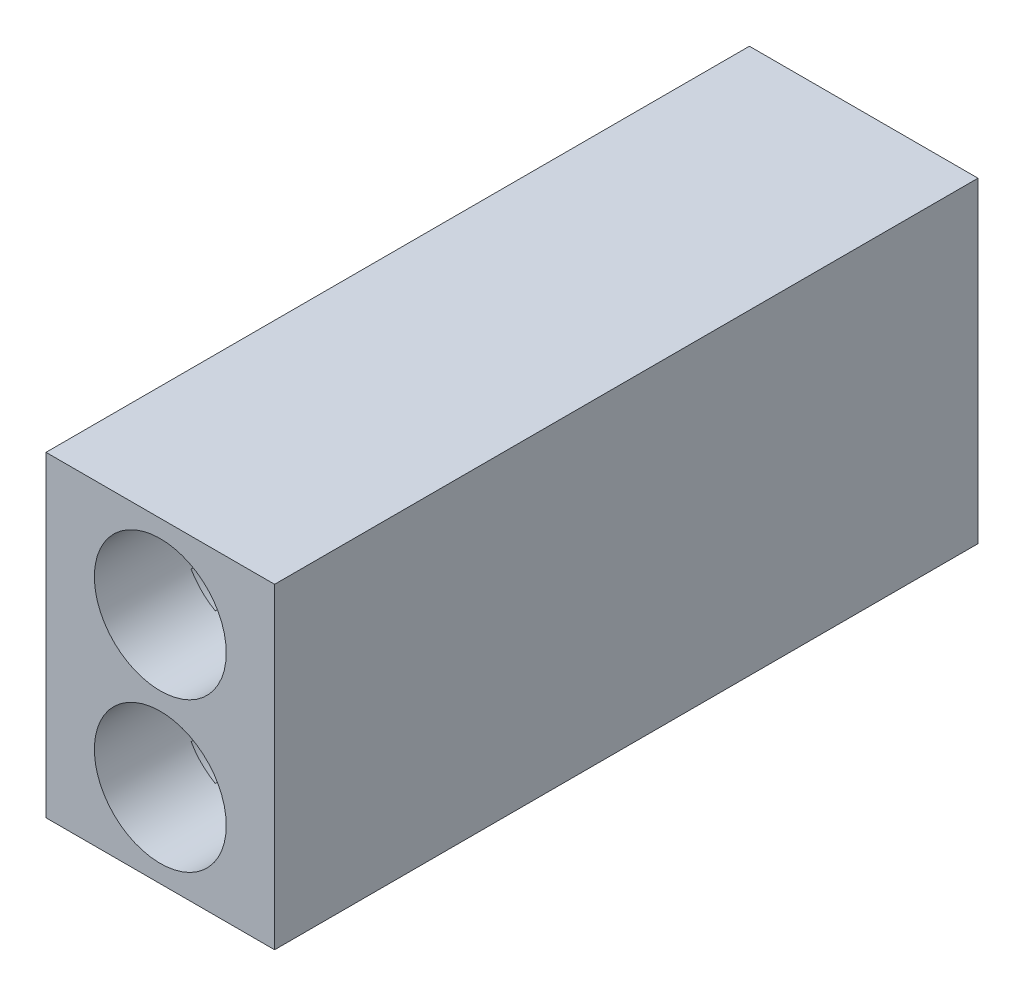
from build123d import *

# Parameters (mm, degrees)
SKETCH_1_W               = 130
SKETCH_1_H               = 180
EXTRUDE_1_DEPTH          = 400
SKETCH_2_R               = 37.5
CUT_EXTRUDE_1_DEPTH      = 458.493169348
CUT_EXTRUDE_START        = -350
CUT_EXTRUDE_2_DEPTH      = 350
PATTERN_CIRCULAR_1_COUNT = 4
MIRROR_START             = -350
MIRROR_1_COPY_1_DEPTH    = 350
MIRROR_1_COPY_2_DEPTH    = 350
MIRROR_1_COPY_3_DEPTH    = 350
MIRROR_1_COPY_4_DEPTH    = 350


with BuildPart() as part:
    # 草圖1 → 填料-伸長1 (new body)
    with BuildSketch(Plane.XY):
        with Locations((-65, 90)):
            Rectangle(SKETCH_1_W, SKETCH_1_H)
    extrude(amount=EXTRUDE_1_DEPTH)

    # 草圖2 → 除料-伸長1 (cut, through all)
    with BuildSketch(Plane.XY.offset(400)):
        with Locations((-65, 132.5)):
            Circle(SKETCH_2_R)
        with Locations((-65, 47.5)):
            Circle(SKETCH_2_R)
    extrude(amount=-CUT_EXTRUDE_1_DEPTH, mode=Mode.SUBTRACT)

    # 草圖4 → 除料-伸長2 (cut)
    with BuildSketch(Plane(origin=(0, 0, 0), x_dir=(-1, 0, 0), z_dir=(0, 0, -1)).offset(CUT_EXTRUDE_START)):
        with BuildLine():
            Line((86.25, 169.306079661), (83.75, 164.975952642))
            ThreePointArc((83.75, 164.975952642), (91.516504294, 159.016504294), (97.475952642, 151.25))
            Line((97.475952642, 151.25), (101.806079661, 153.75))
            ThreePointArc((101.806079661, 153.75), (95.0520382, 162.5520382), (86.25, 169.306079661))
        make_face()
    cut_extrude_2 = extrude(amount=CUT_EXTRUDE_2_DEPTH, mode=Mode.SUBTRACT)

    # 環狀複製排列1: 除料-伸長2 ×4 about axis
    pattern_circular_1_axis = Axis((-65, 132.5, 0), (0, 0, 1))
    for i in range(1, PATTERN_CIRCULAR_1_COUNT):
        add(cut_extrude_2.rotate(pattern_circular_1_axis, i * 360 / PATTERN_CIRCULAR_1_COUNT), mode=Mode.SUBTRACT)

    # 鏡射1 copy 1 sketch → 鏡射1 copy 1 (cut)
    with BuildSketch(Plane(origin=(67.5, -17.5, 0), x_dir=(0, 1, 0), z_dir=(0, 0, -1)).offset(MIRROR_START)):
        with BuildLine():
            Line((86.25, -169.306079661), (83.75, -164.975952642))
            ThreePointArc((83.75, -164.975952642), (91.516504294, -159.016504294), (97.475952642, -151.25))
            Line((97.475952642, -151.25), (101.806079661, -153.75))
            ThreePointArc((101.806079661, -153.75), (95.0520382, -162.5520382), (86.25, -169.306079661))
        make_face()
    extrude(amount=MIRROR_1_COPY_1_DEPTH, mode=Mode.SUBTRACT)

    # 鏡射1 copy 2 sketch → 鏡射1 copy 2 (cut)
    with BuildSketch(Plane(origin=(-130, -85, 0), x_dir=(1, 0, 0), z_dir=(0, 0, -1)).offset(MIRROR_START)):
        with BuildLine():
            Line((86.25, -169.306079661), (83.75, -164.975952642))
            ThreePointArc((83.75, -164.975952642), (91.516504294, -159.016504294), (97.475952642, -151.25))
            Line((97.475952642, -151.25), (101.806079661, -153.75))
            ThreePointArc((101.806079661, -153.75), (95.0520382, -162.5520382), (86.25, -169.306079661))
        make_face()
    extrude(amount=MIRROR_1_COPY_2_DEPTH, mode=Mode.SUBTRACT)

    # 鏡射1 copy 3 sketch → 鏡射1 copy 3 (cut)
    with BuildSketch(Plane(origin=(-197.5, 112.5, 0), x_dir=(0, -1, 0), z_dir=(0, 0, -1)).offset(MIRROR_START)):
        with BuildLine():
            Line((86.25, -169.306079661), (83.75, -164.975952642))
            ThreePointArc((83.75, -164.975952642), (91.516504294, -159.016504294), (97.475952642, -151.25))
            Line((97.475952642, -151.25), (101.806079661, -153.75))
            ThreePointArc((101.806079661, -153.75), (95.0520382, -162.5520382), (86.25, -169.306079661))
        make_face()
    extrude(amount=MIRROR_1_COPY_3_DEPTH, mode=Mode.SUBTRACT)

    # 鏡射1 copy 4 sketch → 鏡射1 copy 4 (cut)
    with BuildSketch(Plane(origin=(0, 180, 0), x_dir=(-1, 0, 0), z_dir=(0, 0, -1)).offset(MIRROR_START)):
        with BuildLine():
            Line((86.25, -169.306079661), (83.75, -164.975952642))
            ThreePointArc((83.75, -164.975952642), (91.516504294, -159.016504294), (97.475952642, -151.25))
            Line((97.475952642, -151.25), (101.806079661, -153.75))
            ThreePointArc((101.806079661, -153.75), (95.0520382, -162.5520382), (86.25, -169.306079661))
        make_face()
    extrude(amount=MIRROR_1_COPY_4_DEPTH, mode=Mode.SUBTRACT)


solid = part.part
